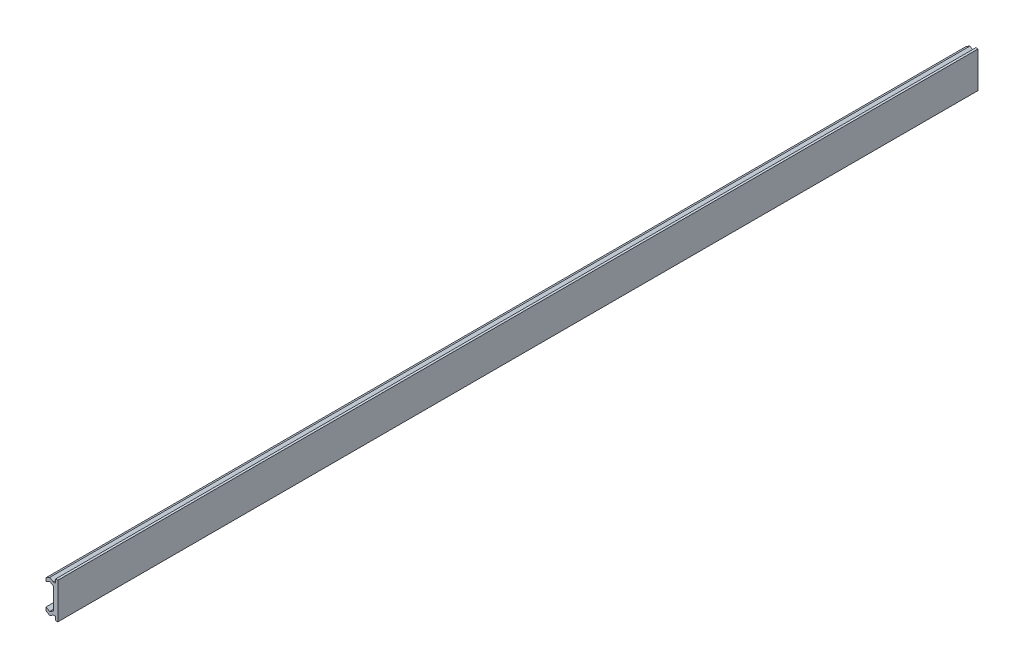
from build123d import *

# Parameters (mm, degrees)
BOSS_EXTRUDE1_DEPTH = 125


with BuildPart() as part:
    # Sketch1 → Boss-Extrude1 (new, symmetric)
    with BuildSketch(Plane.XY):
        Polygon((0, -4.9), (0, 4.9), (-0.6, 4.9), (-0.6, 3.9), (-1.2, 3.9), (-2.2, 4.477350269), (-3.2, 3.9), (-3.2, 2.975), (-2.2, 3.552350269), (-1.2, 2.975), (-1.2, -2.975), (-2.2, -3.552350269), (-3.2, -2.975), (-3.2, -3.9), (-2.2, -4.477350269), (-1.2, -3.9), (-0.6, -3.9), (-0.6, -4.9), align=None)
    extrude(amount=BOSS_EXTRUDE1_DEPTH, both=True)


solid = part.part
